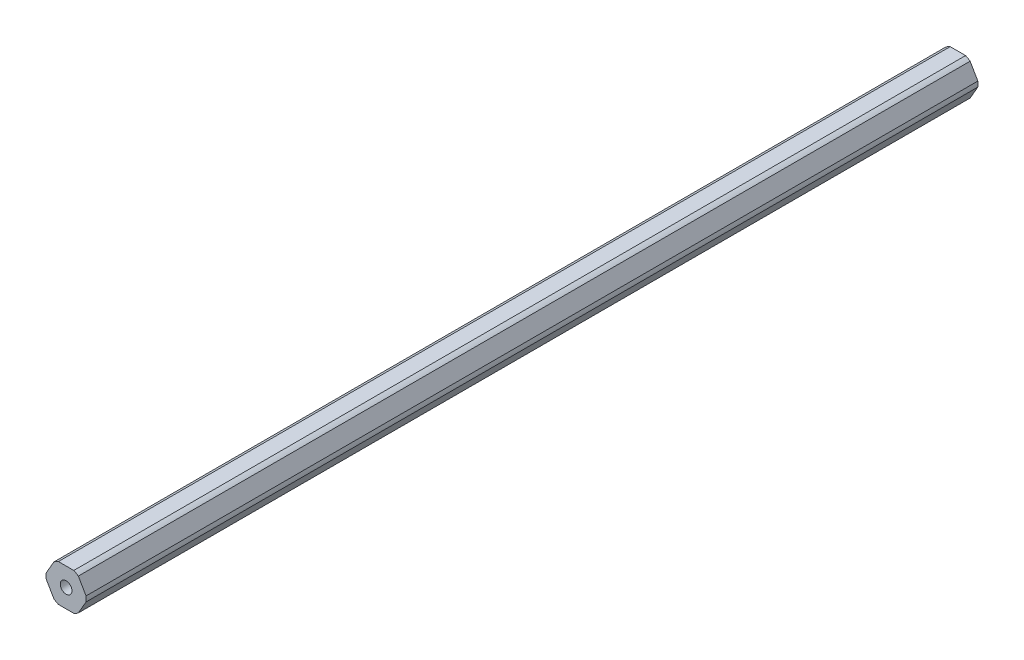
from build123d import *

# Parameters (mm, degrees)
SKETCH1_R           = 2.000000064
BOSS_EXTRUDE1_DEPTH = 152.4


with BuildPart() as part:
    # Sketch1 → Boss-Extrude1 (new, symmetric)
    with BuildSketch(Plane.XY):
        with BuildLine():
            ThreePointArc((4.181770846, 5.456960429), (3.437499983, 5.953924622), (2.634980936, 6.35))
            Line((2.634980936, 6.35), (-2.634980936, 6.35))
            ThreePointArc((-2.634980936, 6.35), (-3.437499983, 5.953924622), (-4.181770846, 5.456960429))
            Line((-4.181770846, 5.456960429), (-6.816751782, 0.893039571))
            ThreePointArc((-6.816751782, 0.893039571), (-6.874999966, 0), (-6.816751782, -0.893039571))
            Line((-6.816751782, -0.893039571), (-4.181770846, -5.456960429))
            ThreePointArc((-4.181770846, -5.456960429), (-3.437499983, -5.953924622), (-2.634980936, -6.35))
            Line((-2.634980936, -6.35), (2.634980936, -6.35))
            ThreePointArc((2.634980936, -6.35), (3.437499983, -5.953924622), (4.181770846, -5.456960429))
            Line((4.181770846, -5.456960429), (6.816751782, -0.893039571))
            ThreePointArc((6.816751782, -0.893039571), (6.860422465, -0.447468582), (6.874999966, 0))
            ThreePointArc((6.874999966, 0), (6.860422465, 0.447468582), (6.816751782, 0.893039571))
            Line((6.816751782, 0.893039571), (4.181770846, 5.456960429))
        make_face()
        with Locations(Location((0, 0, 0), (0, 0, 180))):
            Circle(SKETCH1_R, mode=Mode.SUBTRACT)
    extrude(amount=BOSS_EXTRUDE1_DEPTH, both=True)


solid = part.part
